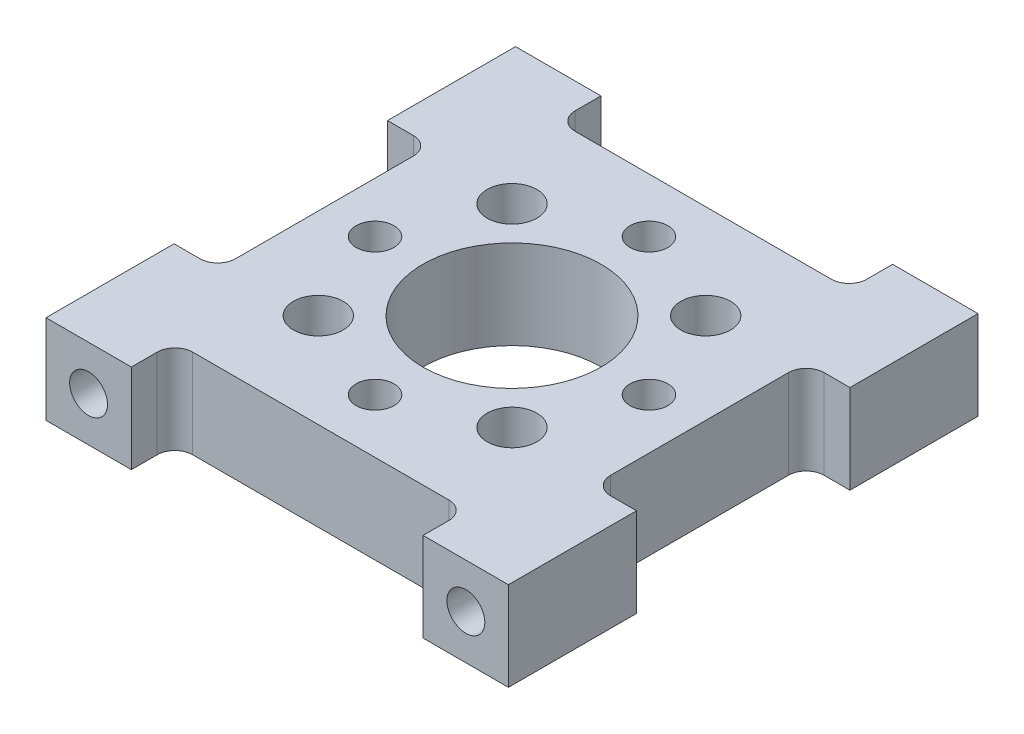
from build123d import *

# Parameters (mm, degrees)
SKETCH1_W                  = 33.02
SKETCH1_H                  = 33.528
BOSS_EXTRUDE1_DEPTH        = 6.35
SKETCH2_W                  = 3.11912
SKETCH2_H                  = 15.24
CUT_EXTRUDE1_DEPTH         = 25.370767243
SKETCH3_W                  = 20.828
SKETCH3_H                  = 3.1115
CUT_EXTRUDE2_DEPTH         = 25.370767243
SKETCH4_W                  = 3.11912
SKETCH4_H                  = 15.24
CUT_EXTRUDE3_DEPTH         = 25.370767243
SKETCH5_W                  = 20.828
SKETCH5_H                  = 3.1115
CUT_EXTRUDE4_DEPTH         = 25.370767243
HOLE1_D                    = 12.7254
M2_5_CLEARANCE_HOLE1_D     = 2.7051
M3_CLEARANCE_HOLE1_D       = 3.556
M2_5_CLEARANCE_HOLE2_D     = 2.7051
M2_5_CLEARANCE_HOLE2_DEPTH = 7.62
M2_5_CLEARANCE_HOLE2_TIP   = 0.81269403
M2_5_CLEARANCE_HOLE3_D     = 2.7051
M2_5_CLEARANCE_HOLE3_DEPTH = 7.62
M2_5_CLEARANCE_HOLE3_TIP   = 0.81269403
FILLET1_R                  = 1.27


with BuildPart() as part:
    # Sketch1 → Boss-Extrude1 (new body)
    with BuildSketch(Plane.XZ):
        Rectangle(SKETCH1_W, SKETCH1_H)
    extrude(amount=-BOSS_EXTRUDE1_DEPTH)

    # Sketch2 → Cut-Extrude1 (cut, through all)
    with BuildSketch(Plane(origin=(0, 6.35, 0), x_dir=(-1, 0, 0), z_dir=(0, 1, 0))):
        with Locations((-14.95044, 0)):
            Rectangle(SKETCH2_W, SKETCH2_H)
    extrude(amount=-CUT_EXTRUDE1_DEPTH, mode=Mode.SUBTRACT)

    # Sketch3 → Cut-Extrude2 (cut, through all)
    with BuildSketch(Plane(origin=(0, 6.35, 0), x_dir=(-1, 0, 0), z_dir=(0, 1, 0))):
        with Locations((0, 15.20825)):
            Rectangle(SKETCH3_W, SKETCH3_H)
    extrude(amount=-CUT_EXTRUDE2_DEPTH, mode=Mode.SUBTRACT)

    # Sketch4 → Cut-Extrude3 (cut, through all)
    with BuildSketch(Plane(origin=(0, 6.35, 0), x_dir=(-1, 0, 0), z_dir=(0, 1, 0))):
        with Locations((14.95044, 0)):
            Rectangle(SKETCH4_W, SKETCH4_H)
    extrude(amount=-CUT_EXTRUDE3_DEPTH, mode=Mode.SUBTRACT)

    # Sketch5 → Cut-Extrude4 (cut, through all)
    with BuildSketch(Plane(origin=(0, 6.35, 0), x_dir=(-1, 0, 0), z_dir=(0, 1, 0))):
        with Locations((0, -15.20825)):
            Rectangle(SKETCH5_W, SKETCH5_H)
    extrude(amount=-CUT_EXTRUDE4_DEPTH, mode=Mode.SUBTRACT)

    # Hole1 (through all)
    with Locations(Plane(origin=(0, 6.35, 0), x_dir=(1, 0, 0), z_dir=(0, 1, 0))):
        with Locations((0, 0)):
            Hole(HOLE1_D / 2)

    # M2.5 Clearance Hole1 (through all)
    with Locations(Plane(origin=(0, 6.35, 0), x_dir=(1, 0, 0), z_dir=(0, 1, 0))):
        with Locations((0, 9.779), (9.779, 0), (0, -9.779), (-9.779, 0)):
            Hole(M2_5_CLEARANCE_HOLE1_D / 2)

    # M3 Clearance Hole1 (through all)
    with Locations(Plane(origin=(0, 6.35, 0), x_dir=(1, 0, 0), z_dir=(0, 1, 0))):
        with Locations((-6.914797213, -6.914797213), (6.914797213, -6.914797213), (6.914797213, 6.914797213), (-6.914797213, 6.914797213)):
            Hole(M3_CLEARANCE_HOLE1_D / 2)

    # M2.5 Clearance Hole2
    with Locations(Plane(origin=(0, 0, -16.764), x_dir=(-1, 0, 0), z_dir=(0, 0, -1))):
        with Locations((13.470382, 3.175), (-13.470382, 3.175)):
            Hole(M2_5_CLEARANCE_HOLE2_D / 2, depth=M2_5_CLEARANCE_HOLE2_DEPTH)
            with Locations((0, 0, -(M2_5_CLEARANCE_HOLE2_DEPTH + M2_5_CLEARANCE_HOLE2_TIP / 2))):  # 118° drill point
                Cone(0, M2_5_CLEARANCE_HOLE2_D / 2, M2_5_CLEARANCE_HOLE2_TIP, mode=Mode.SUBTRACT)

    # M2.5 Clearance Hole3
    with Locations(Plane.XY.offset(16.764)):
        with Locations((13.470382, 3.175), (-13.470382, 3.175)):
            Hole(M2_5_CLEARANCE_HOLE3_D / 2, depth=M2_5_CLEARANCE_HOLE3_DEPTH)
            with Locations((0, 0, -(M2_5_CLEARANCE_HOLE3_DEPTH + M2_5_CLEARANCE_HOLE3_TIP / 2))):  # 118° drill point
                Cone(0, M2_5_CLEARANCE_HOLE3_D / 2, M2_5_CLEARANCE_HOLE3_TIP, mode=Mode.SUBTRACT)

    # Fillet1
    fillet1_edges = [part.edges().sort_by_distance(p)[0] for p in [
        (13.39088, 3.175, 7.62),
        (13.39088, 3.175, -7.62),
        (-10.414, 3.175, 13.6525),
        (10.414, 3.175, 13.6525),
        (-13.39088, 3.175, -7.62),
        (-13.39088, 3.175, 7.62),
        (10.414, 3.175, -13.6525),
        (-10.414, 3.175, -13.6525),
    ]]
    fillet(fillet1_edges, radius=FILLET1_R)


solid = part.part
